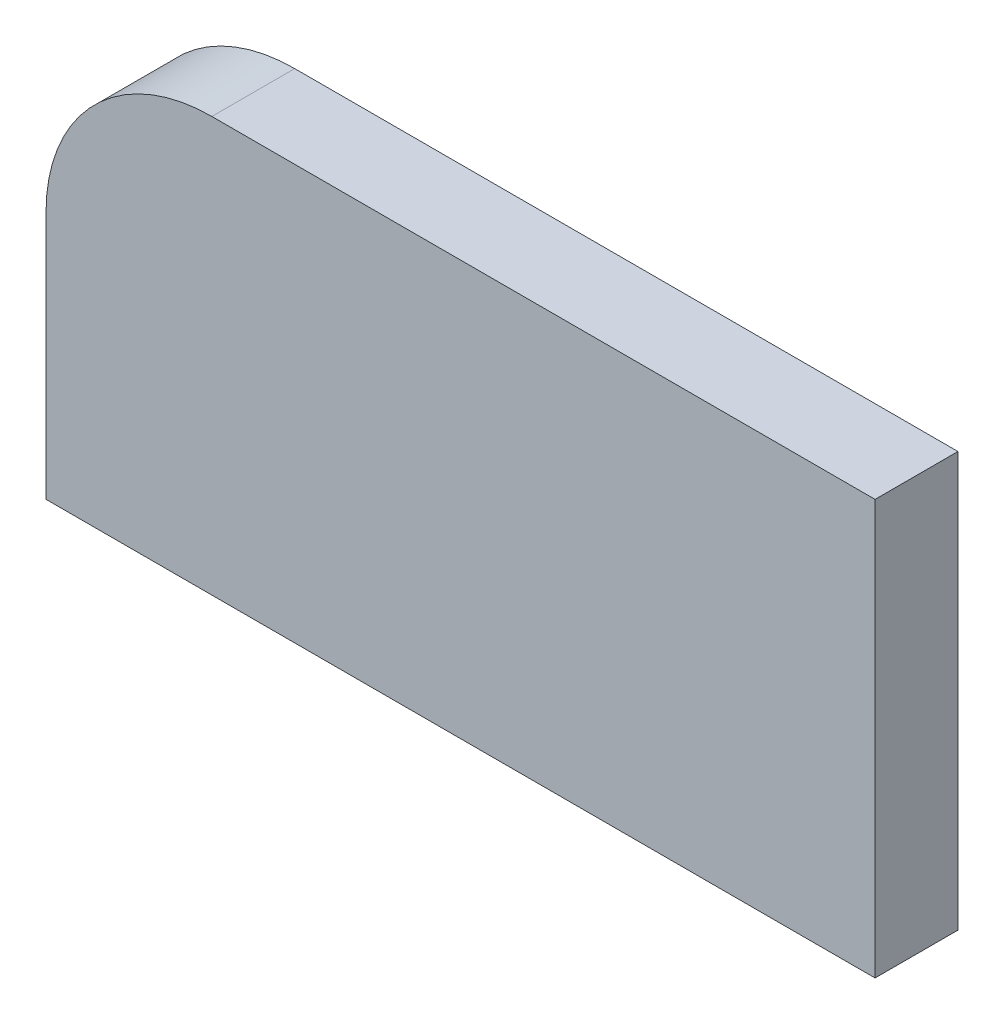
from build123d import *

# Parameters (mm, degrees)
EXTRUSION1_DEPTH = 5


with BuildPart() as part:
    # Esquisse1 → Extrusion1 (new body)
    with BuildSketch(Plane.XY):
        with BuildLine():
            Line((29, 12.5), (-11, 12.5))
            ThreePointArc((-11, 12.5), (-18.071067812, 9.571067812), (-21, 2.5))
            Line((-21, 2.5), (-21, -12.5))
            Line((-21, -12.5), (29, -12.5))
            Line((29, -12.5), (29, 12.5))
        make_face()
    extrude(amount=EXTRUSION1_DEPTH)


solid = part.part
